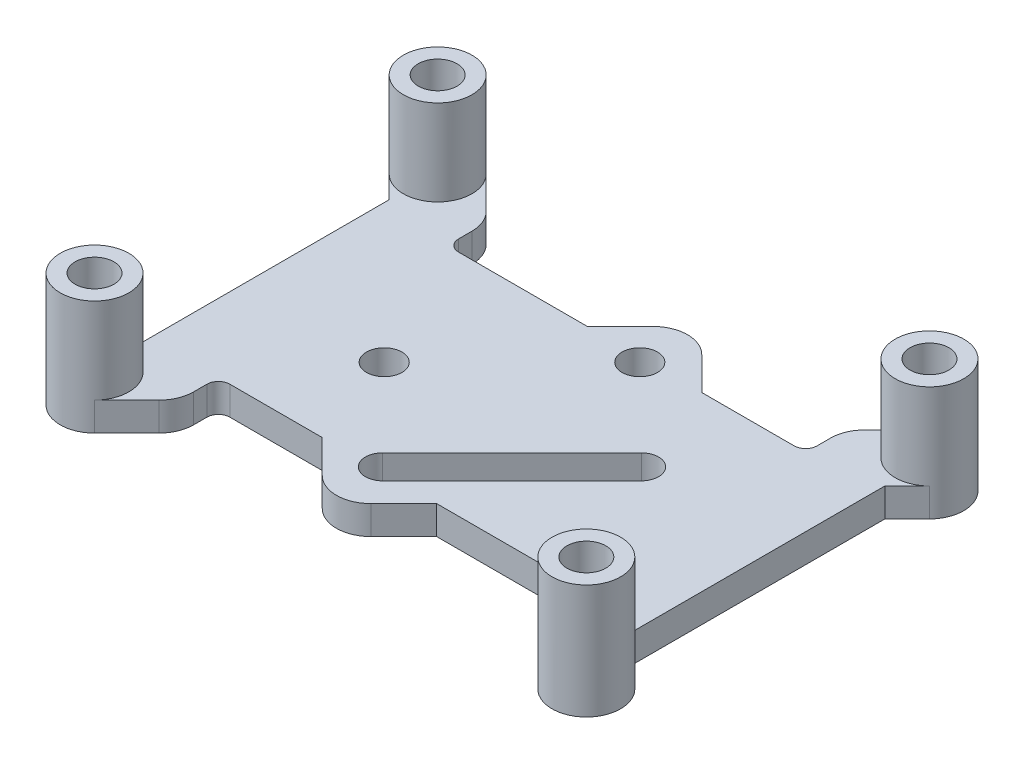
from build123d import *
from build123d.topology import SkipClean

# Parameters (mm, degrees)
SKETCH1_R               = 3
SKETCH1_R_2             = 1.7
BOSS_EXTRUDE1_DEPTH     = 10
BOSS_EXTRUDE1_2_DEPTH   = 10
BOSS_EXTRUDE1_3_DEPTH   = 10
BOSS_EXTRUDE1_4_DEPTH   = 10
BOSS_EXTRUDE2_DEPTH     = 2.5
CUT_EXTRUDE1_DEPTH      = 33.003906012
CUT_EXTRUDE1_DEPTH_BACK = 33.003906012
SKETCH1_2_R             = 1.7
SKETCH4_W               = 31.34314575
SKETCH4_H               = 20
BOSS_EXTRUDE3_DEPTH     = 2.5
FILLET2_R               = 1
BOSS_EXTRUDE4_DEPTH     = 2.5
CUT_EXTRUDE3_DEPTH      = 33.003906012
CUT_EXTRUDE3_DEPTH_BACK = 33.003906012
SKETCH5_R               = 1.55
FILLET3_R               = 3


with BuildPart() as part:
    # Sketch1 → Boss-Extrude1 (new body)
    with BuildSketch(Plane(origin=(0, 0, 0), x_dir=(1, 0, 0), z_dir=(0, 1, 0))):
        with Locations(Location((-21.5, 15, 0), (0, 0, 270))):
            Circle(SKETCH1_R)
        with Locations(Location((-21.5, 15, 0), (0, 0, 270))):
            Circle(SKETCH1_R_2, mode=Mode.SUBTRACT)
    extrude(amount=BOSS_EXTRUDE1_DEPTH)



with BuildPart() as body_2:
    # Sketch1 → Boss-Extrude1 2 (new body)
    with BuildSketch(Plane(origin=(0, 0, 0), x_dir=(1, 0, 0), z_dir=(0, 1, 0))):
        with Locations(Location((-21.5, -15, 0), (0, 0, 270))):
            Circle(SKETCH1_R)
        with Locations(Location((-21.5, -15, 0), (0, 0, 270))):
            Circle(SKETCH1_R_2, mode=Mode.SUBTRACT)
    extrude(amount=BOSS_EXTRUDE1_2_DEPTH)


with BuildPart() as body_3:
    # Sketch1 → Boss-Extrude1 3 (new body)
    with BuildSketch(Plane(origin=(0, 0, 0), x_dir=(1, 0, 0), z_dir=(0, 1, 0))):
        with Locations(Location((21.5, -15, 0), (0, 0, 270))):
            Circle(SKETCH1_R)
        with Locations(Location((21.5, -15, 0), (0, 0, 270))):
            Circle(SKETCH1_R_2, mode=Mode.SUBTRACT)
    extrude(amount=BOSS_EXTRUDE1_3_DEPTH)


with BuildPart() as body_4:
    # Sketch1 → Boss-Extrude1 4 (new body)
    with BuildSketch(Plane(origin=(0, 0, 0), x_dir=(1, 0, 0), z_dir=(0, 1, 0))):
        with Locations(Location((21.5, 15, 0), (0, 0, 270))):
            Circle(SKETCH1_R)
        with Locations(Location((21.5, 15, 0), (0, 0, 270))):
            Circle(SKETCH1_R_2, mode=Mode.SUBTRACT)
    extrude(amount=BOSS_EXTRUDE1_4_DEPTH)


with BuildPart() as part_1:
    with SkipClean():  # the faces are left unmerged after this step: merging them gives an invalid solid
        add(part.part)

        add(body_2.part)  # Boss-Extrude2 merges body 2

        add(body_3.part)  # Boss-Extrude2 merges body 3

        add(body_4.part)  # Boss-Extrude2 merges body 4
        # Sketch2 → Boss-Extrude2 (add)
        with BuildSketch(Plane(origin=(0, 0, 0), x_dir=(1, 0, 0), z_dir=(0, 1, 0))):
            with BuildLine():
                Line((-15.671572875, 12.171572875), (-15.671572875, -12.171572875))
                ThreePointArc((-15.671572875, -12.171572875), (-15.899934278, -13.319623172), (-16.550252532, -14.292893219))
                Line((-16.550252532, -14.292893219), (-19.378679656, -17.121320344))
                ThreePointArc((-19.378679656, -17.121320344), (-23.621320344, -17.121320344), (-23.621320344, -12.878679656))
                Line((-23.621320344, -12.878679656), (-21.671572875, -10.928932188))
                Line((-21.671572875, -10.928932188), (-21.671572875, 10.928932188))
                Line((-21.671572875, 10.928932188), (-23.621320344, 12.878679656))
                ThreePointArc((-23.621320344, 12.878679656), (-23.621320344, 17.121320344), (-19.378679656, 17.121320344))
                Line((-19.378679656, 17.121320344), (-16.550252532, 14.292893219))
                ThreePointArc((-16.550252532, 14.292893219), (-15.899934278, 13.319623172), (-15.671572875, 12.171572875))
            make_face()
            with BuildLine():
                ThreePointArc((19.378679656, 17.121320344), (23.621320344, 17.121320344), (23.621320344, 12.878679656))
                Line((23.621320344, 12.878679656), (21.671572875, 10.928932188))
                Line((21.671572875, 10.928932188), (21.671572875, -10.928932188))
                Line((21.671572875, -10.928932188), (23.621320344, -12.878679656))
                ThreePointArc((23.621320344, -12.878679656), (23.621320344, -17.121320344), (19.378679656, -17.121320344))
                Line((19.378679656, -17.121320344), (16.550252532, -14.292893219))
                ThreePointArc((16.550252532, -14.292893219), (15.899934278, -13.319623172), (15.671572875, -12.171572875))
                Line((15.671572875, -12.171572875), (15.671572875, 12.171572875))
                ThreePointArc((15.671572875, 12.171572875), (15.899934278, 13.319623172), (16.550252532, 14.292893219))
                Line((16.550252532, 14.292893219), (19.378679656, 17.121320344))
            make_face()
        extrude(amount=BOSS_EXTRUDE2_DEPTH)

    # Sketch1<2> → Cut-Extrude1 (cut, two sides: drawn at the far end of the back side and taken through both)
    with SkipClean():  # the faces are left unmerged after this step: merging them gives an invalid solid
        with BuildSketch(Plane(origin=(0, 0, 0), x_dir=(1, 0, 0), z_dir=(0, 1, 0)).offset(-CUT_EXTRUDE1_DEPTH_BACK)):
            with Locations(Location((-21.5, -15, 0), (0, 0, 270))):
                Circle(SKETCH1_2_R)
            with Locations(Location((-21.5, 15, 0), (0, 0, 270))):
                Circle(SKETCH1_2_R)
            with Locations(Location((21.5, 15, 0), (0, 0, 270))):
                Circle(SKETCH1_2_R)
            with Locations(Location((21.5, -15, 0), (0, 0, 270))):
                Circle(SKETCH1_2_R)
        extrude(amount=CUT_EXTRUDE1_DEPTH + CUT_EXTRUDE1_DEPTH_BACK, mode=Mode.SUBTRACT)

    # Sketch4 → Boss-Extrude3 (add)
    with SkipClean():  # the faces are left unmerged after this step: merging them gives an invalid solid
        with BuildSketch(Plane(origin=(0, 0, 0), x_dir=(1, 0, 0), z_dir=(0, 1, 0))):
            Rectangle(SKETCH4_W, SKETCH4_H)
        extrude(amount=BOSS_EXTRUDE3_DEPTH)

    # Fillet2
    fillet2_edges = [part_1.edges().sort_by_distance(p)[0] for p in [
        (15.671572875, 1.25, 10),
        (15.671572875, 1.25, -10),
        (-15.671572875, 1.25, -10),
        (-15.671572875, 1.25, 10),
    ]]
    fillet(fillet2_edges, radius=FILLET2_R)

    # Sketch6 → Boss-Extrude4 (add)
    with SkipClean():  # the faces are left unmerged after this step: merging them gives an invalid solid
        with BuildSketch(Plane.XZ):
            Polygon((1.590990258, -4.16259377), (-3.827712857, -9.581296885), (1.590990258, -15), (7.009693373, -9.581296885), align=None)
            Polygon((-1.590990258, 15), (-9.445268772, 7.145721485), (-1.590990258, -0.70855703), (6.263288257, 7.145721485), align=None)
        extrude(amount=-BOSS_EXTRUDE4_DEPTH)

    # Sketch5 → Cut-Extrude3 (cut, two sides: drawn at the far end of the back side and taken through both)
    with SkipClean():  # the faces are left unmerged after this step: merging them gives an invalid solid
        with BuildSketch(Plane.XZ.offset(-CUT_EXTRUDE3_DEPTH_BACK)):
            with Locations(Location((-9.581296885, 1.590990258, 0), (0, 0, 90))):
                Circle(SKETCH5_R)
            with Locations(Location((1.590990258, -9.581296885, 0), (0, 0, 90))):
                Circle(SKETCH5_R)
            with BuildLine():
                Line((-0.671751442, 10.641957057), (10.641957057, -0.671751442))
                ThreePointArc((10.641957057, -0.671751442), (10.641957057, -2.793071786), (8.520636713, -2.793071786))
                Line((8.520636713, -2.793071786), (-2.793071786, 8.520636713))
                ThreePointArc((-2.793071786, 8.520636713), (-2.793071786, 10.641957057), (-0.671751442, 10.641957057))
            make_face()
        extrude(amount=CUT_EXTRUDE3_DEPTH + CUT_EXTRUDE3_DEPTH_BACK, mode=Mode.SUBTRACT)

    # Fillet3
    fillet3_edges = [part_1.edges().sort_by_distance(p)[0] for p in [
        (1.590990258, 1.25, -15),
        (-1.590990258, 1.25, 15),
    ]]
    fillet(fillet3_edges, radius=FILLET3_R)


solid = part_1.part
